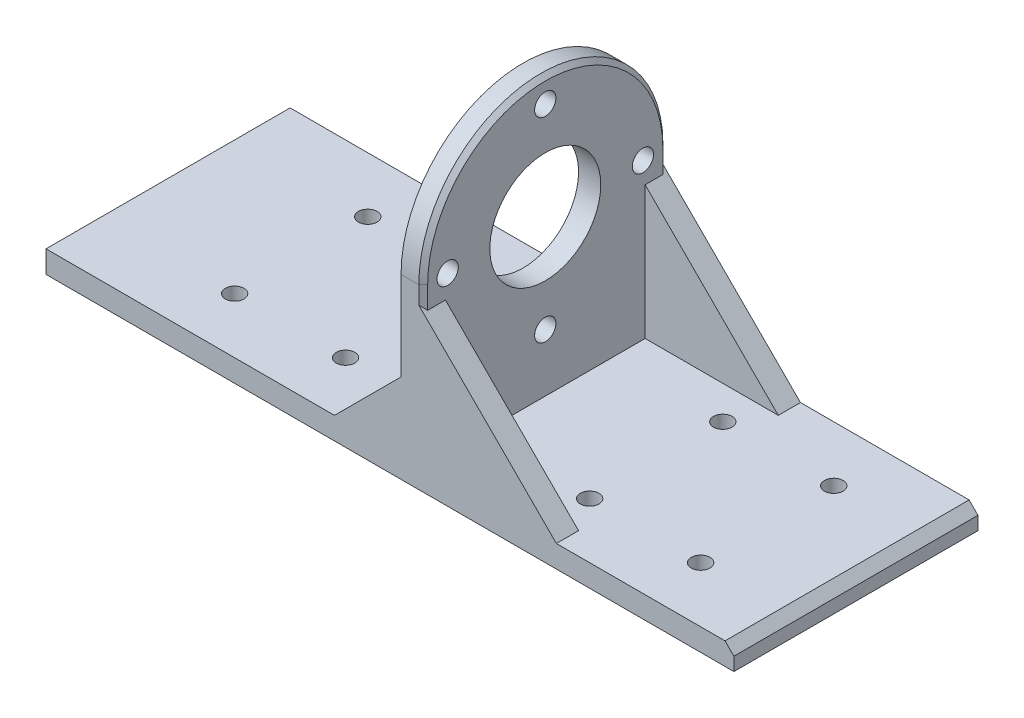
from build123d import *

# Parameters (mm, degrees)
SKETCH_1_R          = 12.5
SKETCH_1_R_2        = 2.4
EXTRUDE_1_DEPTH     = 5
SKETCH_2_W          = 55
SKETCH_2_H          = 5
EXTRUDE_2_DEPTH     = 80
RIB_1_REACH         = 105.712
SKETCH_3_WALL_W     = 230.637888562
SKETCH_3_WALL_H     = 5
CHAMFER_2_SIZE      = 5
SKETCH_4_W          = 55
SKETCH_4_H          = 5
EXTRUDE_3_DEPTH     = 70
RIB_6_REACH         = 105.712
SKETCH_5_WALL_W     = 251.851091998
SKETCH_5_WALL_H     = 5
CUT_EXTRUDE_1_REACH = 107.178
SKETCH_6_R          = 2.1
CHAMFER_3_SIZE      = 1
CHAMFER_4_SIZE      = 2


with BuildPart() as part:
    # 草图1 → 凸台-拉伸1 (new body)
    with BuildSketch(Plane(origin=(0, 0, 0), x_dir=(0, 0, -1), z_dir=(1, 0, 0))):
        with BuildLine():
            Line((-27.5, 0), (-27.5, -40))
            Line((-27.5, -40), (27.5, -40))
            Line((27.5, -40), (27.5, 0))
            ThreePointArc((27.5, 0), (0, 27.5), (-27.5, 0))
        make_face()
        Circle(SKETCH_1_R, mode=Mode.SUBTRACT)
        with Locations((0, 22)):
            Circle(SKETCH_1_R_2, mode=Mode.SUBTRACT)
        with Locations((22, 0)):
            Circle(SKETCH_1_R_2, mode=Mode.SUBTRACT)
        with Locations((0, -22)):
            Circle(SKETCH_1_R_2, mode=Mode.SUBTRACT)
        with Locations((-22, 0)):
            Circle(SKETCH_1_R_2, mode=Mode.SUBTRACT)
    extrude(amount=EXTRUDE_1_DEPTH)

    # 草图2 → 凸台-拉伸2 (add)
    with BuildSketch(Plane.ZY):
        with Locations((0, -37.5)):
            Rectangle(SKETCH_2_W, SKETCH_2_H)
    extrude(amount=EXTRUDE_2_DEPTH)

    # 草图3 wall → 筋1 (add, up to next)
    with BuildSketch(Plane(origin=(-7.5, -27.5, 25), x_dir=(0.707106781187, 0.707106781187, 0), z_dir=(-0.707106781187, 0.707106781187, 0)), mode=Mode.PRIVATE) as rib_1_sk1:
        Rectangle(SKETCH_3_WALL_W, SKETCH_3_WALL_H)
    rib_1_tool1 = extrude(rib_1_sk1.sketch, amount=-RIB_1_REACH, mode=Mode.PRIVATE) - part.part
    rib_1 = rib_1_tool1.solids().sort_by_distance((-7.5, -27.5, 25))[0]
    add(rib_1)

    # 镜向1: 筋1 across plane
    add(rib_1.mirror(Plane.XY))

    # 倒角2
    chamfer_2_edges = [part.edges().sort_by_distance(p)[0] for p in [
        (0, -35, 0),
    ]]
    chamfer(chamfer_2_edges, length=CHAMFER_2_SIZE)

    # 草图4 → 凸台-拉伸3 (add)
    with BuildSketch(Plane(origin=(5, 0, 0), x_dir=(0, 0, -1), z_dir=(1, 0, 0))):
        with Locations((0, -37.5)):
            Rectangle(SKETCH_4_W, SKETCH_4_H)
    extrude(amount=EXTRUDE_3_DEPTH)

    # 草图5 wall → 筋6 (add, up to next)
    with BuildSketch(Plane(origin=(20, -20, 25), x_dir=(-0.707106781187, 0.707106781187, 0), z_dir=(-0.707106781187, -0.707106781187, 0)), mode=Mode.PRIVATE) as rib_6_sk1:
        Rectangle(SKETCH_5_WALL_W, SKETCH_5_WALL_H)
    rib_6_tool1 = extrude(rib_6_sk1.sketch, amount=RIB_6_REACH, mode=Mode.PRIVATE) - part.part
    rib_6 = rib_6_tool1.solids().sort_by_distance((20, -20, 25))[0]
    add(rib_6)

    # 镜向2: 筋6 across plane
    add(rib_6.mirror(Plane.XY))

    # 草图6 → 切除-拉伸1 (cut, up to next)
    with BuildSketch(Plane(origin=(0, -35, 0), x_dir=(1, 0, 0), z_dir=(0, 1, 0)), mode=Mode.PRIVATE) as cut_extrude_1_sk1:
        with Locations(Location((30, 15, 0), (0, 0, 270))):
            Circle(SKETCH_6_R)
    cut_extrude_1_tool1 = extrude(cut_extrude_1_sk1.sketch, amount=-CUT_EXTRUDE_1_REACH, mode=Mode.PRIVATE) & part.part
    # 草图6 → 切除-拉伸1 (cut, up to next)
    with BuildSketch(Plane(origin=(0, -35, 0), x_dir=(1, 0, 0), z_dir=(0, 1, 0)), mode=Mode.PRIVATE) as cut_extrude_1_sk2:
        with Locations(Location((55, 15, 0), (0, 0, 270))):
            Circle(SKETCH_6_R)
    cut_extrude_1_tool2 = extrude(cut_extrude_1_sk2.sketch, amount=-CUT_EXTRUDE_1_REACH, mode=Mode.PRIVATE) & part.part
    # 草图6 → 切除-拉伸1 (cut, up to next)
    with BuildSketch(Plane(origin=(0, -35, 0), x_dir=(1, 0, 0), z_dir=(0, 1, 0)), mode=Mode.PRIVATE) as cut_extrude_1_sk3:
        with Locations(Location((-50, 15, 0), (0, 0, 270))):
            Circle(SKETCH_6_R)
    cut_extrude_1_tool3 = extrude(cut_extrude_1_sk3.sketch, amount=-CUT_EXTRUDE_1_REACH, mode=Mode.PRIVATE) & part.part
    # 草图6 → 切除-拉伸1 (cut, up to next)
    with BuildSketch(Plane(origin=(0, -35, 0), x_dir=(1, 0, 0), z_dir=(0, 1, 0)), mode=Mode.PRIVATE) as cut_extrude_1_sk4:
        with Locations(Location((-25, 15, 0), (0, 0, 270))):
            Circle(SKETCH_6_R)
    cut_extrude_1_tool4 = extrude(cut_extrude_1_sk4.sketch, amount=-CUT_EXTRUDE_1_REACH, mode=Mode.PRIVATE) & part.part
    # 草图6 → 切除-拉伸1 (cut, up to next)
    with BuildSketch(Plane(origin=(0, -35, 0), x_dir=(1, 0, 0), z_dir=(0, 1, 0)), mode=Mode.PRIVATE) as cut_extrude_1_sk5:
        with Locations(Location((55, -15, 0), (0, 0, 270))):
            Circle(SKETCH_6_R)
    cut_extrude_1_tool5 = extrude(cut_extrude_1_sk5.sketch, amount=-CUT_EXTRUDE_1_REACH, mode=Mode.PRIVATE) & part.part
    # 草图6 → 切除-拉伸1 (cut, up to next)
    with BuildSketch(Plane(origin=(0, -35, 0), x_dir=(1, 0, 0), z_dir=(0, 1, 0)), mode=Mode.PRIVATE) as cut_extrude_1_sk6:
        with Locations(Location((30, -15, 0), (0, 0, 270))):
            Circle(SKETCH_6_R)
    cut_extrude_1_tool6 = extrude(cut_extrude_1_sk6.sketch, amount=-CUT_EXTRUDE_1_REACH, mode=Mode.PRIVATE) & part.part
    # 草图6 → 切除-拉伸1 (cut, up to next)
    with BuildSketch(Plane(origin=(0, -35, 0), x_dir=(1, 0, 0), z_dir=(0, 1, 0)), mode=Mode.PRIVATE) as cut_extrude_1_sk7:
        with Locations(Location((-25, -15, 0), (0, 0, 270))):
            Circle(SKETCH_6_R)
    cut_extrude_1_tool7 = extrude(cut_extrude_1_sk7.sketch, amount=-CUT_EXTRUDE_1_REACH, mode=Mode.PRIVATE) & part.part
    # 草图6 → 切除-拉伸1 (cut, up to next)
    with BuildSketch(Plane(origin=(0, -35, 0), x_dir=(1, 0, 0), z_dir=(0, 1, 0)), mode=Mode.PRIVATE) as cut_extrude_1_sk8:
        with Locations(Location((-50, -15, 0), (0, 0, 270))):
            Circle(SKETCH_6_R)
    cut_extrude_1_tool8 = extrude(cut_extrude_1_sk8.sketch, amount=-CUT_EXTRUDE_1_REACH, mode=Mode.PRIVATE) & part.part
    add(cut_extrude_1_tool1.solids().sort_by_distance((30, -35, -15))[0], mode=Mode.SUBTRACT)
    add(cut_extrude_1_tool2.solids().sort_by_distance((55, -35, -15))[0], mode=Mode.SUBTRACT)
    add(cut_extrude_1_tool3.solids().sort_by_distance((-50, -35, -15))[0], mode=Mode.SUBTRACT)
    add(cut_extrude_1_tool4.solids().sort_by_distance((-25, -35, -15))[0], mode=Mode.SUBTRACT)
    add(cut_extrude_1_tool5.solids().sort_by_distance((55, -35, 15))[0], mode=Mode.SUBTRACT)
    add(cut_extrude_1_tool6.solids().sort_by_distance((30, -35, 15))[0], mode=Mode.SUBTRACT)
    add(cut_extrude_1_tool7.solids().sort_by_distance((-25, -35, 15))[0], mode=Mode.SUBTRACT)
    add(cut_extrude_1_tool8.solids().sort_by_distance((-50, -35, 15))[0], mode=Mode.SUBTRACT)

    # 倒角3
    chamfer_3_edges = [part.edges().sort_by_distance(p)[0] for p in [
        (5, -2.5, -27.5),
        (5, 27.5, 0),
        (5, -2.5, 27.5),
    ]]
    chamfer(chamfer_3_edges, length=CHAMFER_3_SIZE)

    # 倒角4
    chamfer_4_edges = [part.edges().sort_by_distance(p)[0] for p in [
        (75, -35, 0),
    ]]
    chamfer(chamfer_4_edges, length=CHAMFER_4_SIZE)


solid = part.part
